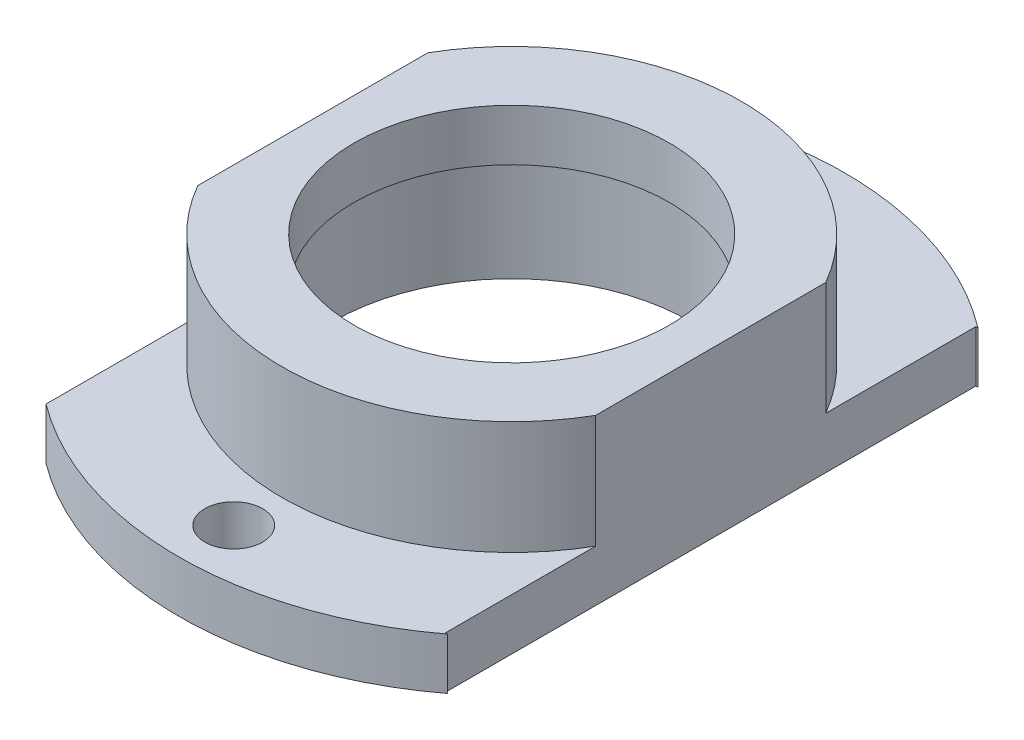
from build123d import *

# Parameters (mm, degrees)
CUT_EXTRUDE1_REACH = 40.962
SKETCH2_W          = 9.385810436
SKETCH2_H          = 34.336908986
SKETCH2_W_2        = 16.426678561
SKETCH2_H_2        = 32.704594128
CUT_EXTRUDE2_REACH = 33.801
SKETCH3_R          = 1.7859375


with BuildPart() as part:
    # Sketch1 → Revolve2 (revolve)
    with BuildSketch(Plane.XY, mode=Mode.PRIVATE) as revolve2_sk:
        Polygon((0, 0), (9.525, 0), (9.525, 3.175), (3.175, 3.175), (3.175, 10.16), (-1.27, 10.16), (-1.27, 6.985), (0, 6.985), align=None)
    revolve(revolve2_sk.sketch.rotate(Axis((-10.9982, 23.074413867, 0), (0, -1, 0)), 180), axis=Axis((-10.9982, 23.074413867, 0), (0, -1, 0)))

    # Cut-Extrude1: up to this face of the body (flat: up to its plane)
    cut_extrude1_end = Plane(part.part.faces().sort_by_distance((0.580483756, 0, 0))[0])
    # Sketch2 → Cut-Extrude1 (cut, up to the picked face)
    with BuildSketch(Plane(origin=(0, 10.16, 0), x_dir=(1, 0, 0), z_dir=(0, 1, 0)), mode=Mode.PRIVATE) as cut_extrude1_sk1:
        with Locations((-27.959305218, 0)):
            Rectangle(SKETCH2_W, SKETCH2_H)
    cut_extrude1_tool1 = split(extrude(cut_extrude1_sk1.sketch, amount=-CUT_EXTRUDE1_REACH, mode=Mode.PRIVATE), bisect_by=cut_extrude1_end, keep=Keep.BOTH, mode=Mode.PRIVATE)
    # Sketch2 → Cut-Extrude1 (cut, up to the picked face)
    with BuildSketch(Plane(origin=(0, 10.16, 0), x_dir=(1, 0, 0), z_dir=(0, 1, 0)), mode=Mode.PRIVATE) as cut_extrude1_sk2:
        with Locations((9.483339281, 0)):
            Rectangle(SKETCH2_W_2, SKETCH2_H_2)
    cut_extrude1_tool2 = split(extrude(cut_extrude1_sk2.sketch, amount=-CUT_EXTRUDE1_REACH, mode=Mode.PRIVATE), bisect_by=cut_extrude1_end, keep=Keep.BOTH, mode=Mode.PRIVATE)
    add(cut_extrude1_tool1.solids().sort_by(Axis((-27.959305, 10.16, 0), (0, -1, 0)))[0], mode=Mode.SUBTRACT)
    add(cut_extrude1_tool2.solids().sort_by(Axis((9.483339, 10.16, 0), (0, -1, 0)))[0], mode=Mode.SUBTRACT)

    # Sketch3 → Cut-Extrude2 (cut, up to next)
    with BuildSketch(Plane(origin=(0, 3.175, 0), x_dir=(1, 0, 0), z_dir=(0, 1, 0)), mode=Mode.PRIVATE) as cut_extrude2_sk1:
        with Locations(Location((-10.9982, 17.145, 0), (0, 0, 180))):
            Circle(SKETCH3_R)
    cut_extrude2_tool1 = extrude(cut_extrude2_sk1.sketch, amount=-CUT_EXTRUDE2_REACH, mode=Mode.PRIVATE) & part.part
    # Sketch3 → Cut-Extrude2 (cut, up to next)
    with BuildSketch(Plane(origin=(0, 3.175, 0), x_dir=(1, 0, 0), z_dir=(0, 1, 0)), mode=Mode.PRIVATE) as cut_extrude2_sk2:
        with Locations(Location((-10.9982, -17.145, 0), (0, 0, 180))):
            Circle(SKETCH3_R)
    cut_extrude2_tool2 = extrude(cut_extrude2_sk2.sketch, amount=-CUT_EXTRUDE2_REACH, mode=Mode.PRIVATE) & part.part
    add(cut_extrude2_tool1.solids().sort_by_distance((-10.9982, 3.175, -17.145))[0], mode=Mode.SUBTRACT)
    add(cut_extrude2_tool2.solids().sort_by_distance((-10.9982, 3.175, 17.145))[0], mode=Mode.SUBTRACT)


solid = part.part
